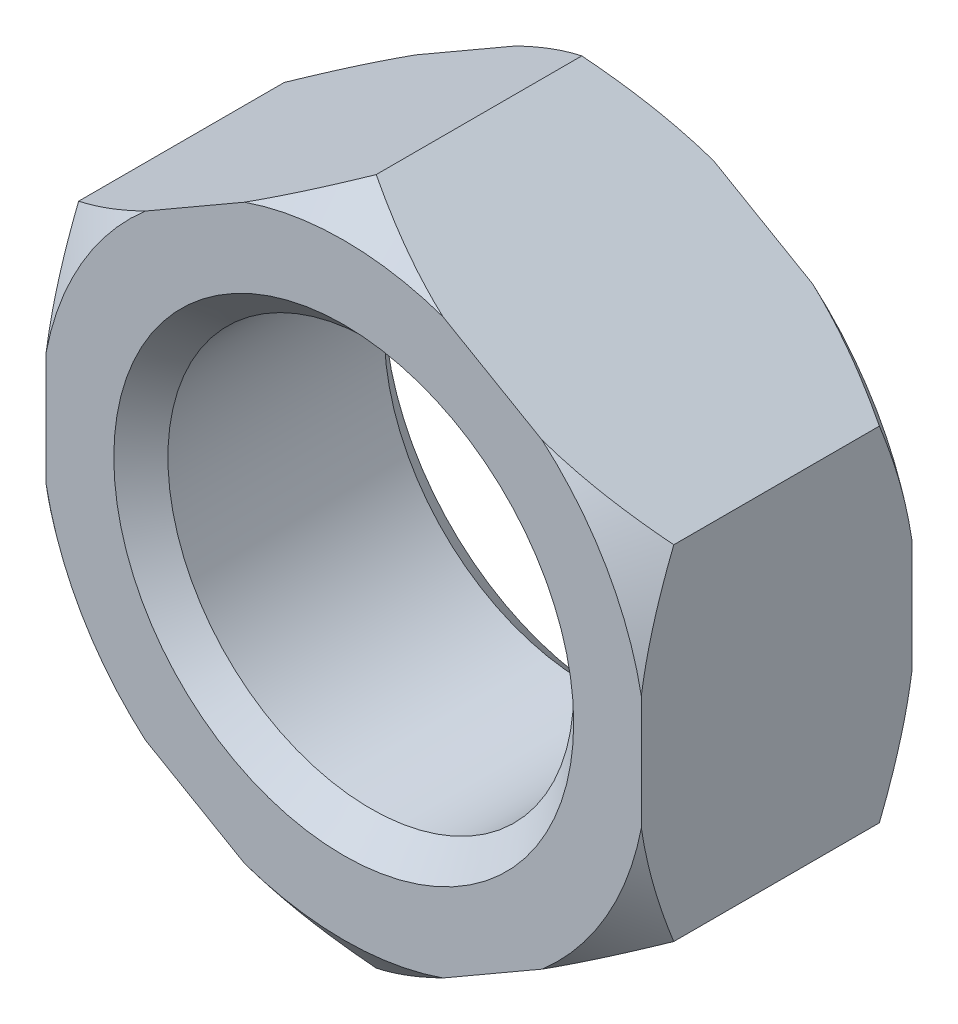
from build123d import *

# Parameters (mm, degrees)
BOSS_EXTRUDE1_DEPTH = 10
SKETCH2_R           = 7.5
CUT_EXTRUDE1_DEPTH  = 20.553345835
CHAMFER1_SIZE       = 1
SCALE1_SCALE        = 0.25


with BuildPart() as part:
    # Sketch1 → Boss-Extrude1 (new body)
    with BuildSketch(Plane.XY):
        Polygon((11, -6.350852961), (11, 6.350852961), (0, 12.701705922), (-11, 6.350852961), (-11, -6.350852961), (0, -12.701705922), align=None)
    extrude(amount=BOSS_EXTRUDE1_DEPTH)

    # Sketch2 → Cut-Extrude1 (cut, through all)
    with BuildSketch(Plane.XY.offset(10)):
        Circle(SKETCH2_R)
    extrude(amount=-CUT_EXTRUDE1_DEPTH, mode=Mode.SUBTRACT)

    # Chamfer1
    chamfer1_edges = [part.edges().sort_by_distance(p)[0] for p in [
        (-7.5, 0, 0),
        (-7.5, 0, 10),
    ]]
    chamfer(chamfer1_edges, length=CHAMFER1_SIZE)

    # Sketch3 → Cut-Revolve1 (revolve, cut)
    with BuildSketch(Plane(origin=(0, 0, 0), x_dir=(0, 0, -1), z_dir=(1, 0, 0))):
        Polygon((-1.2, 12.701705922), (0, 11.201705922), (0, 12.701705922), align=None)
        Polygon((-10, 12.701705922), (-8.8, 12.701705922), (-10, 11.201705922), align=None)
    revolve(axis=Axis((0, 0, 11.931006721), (0, 0, -1)), mode=Mode.SUBTRACT)


with BuildPart() as part_1:
    # Scale1: scaled about (0, 0, 5)
    add(part.part.scale(SCALE1_SCALE).moved(Location((0, 0, 3.75))))


solid = part_1.part
